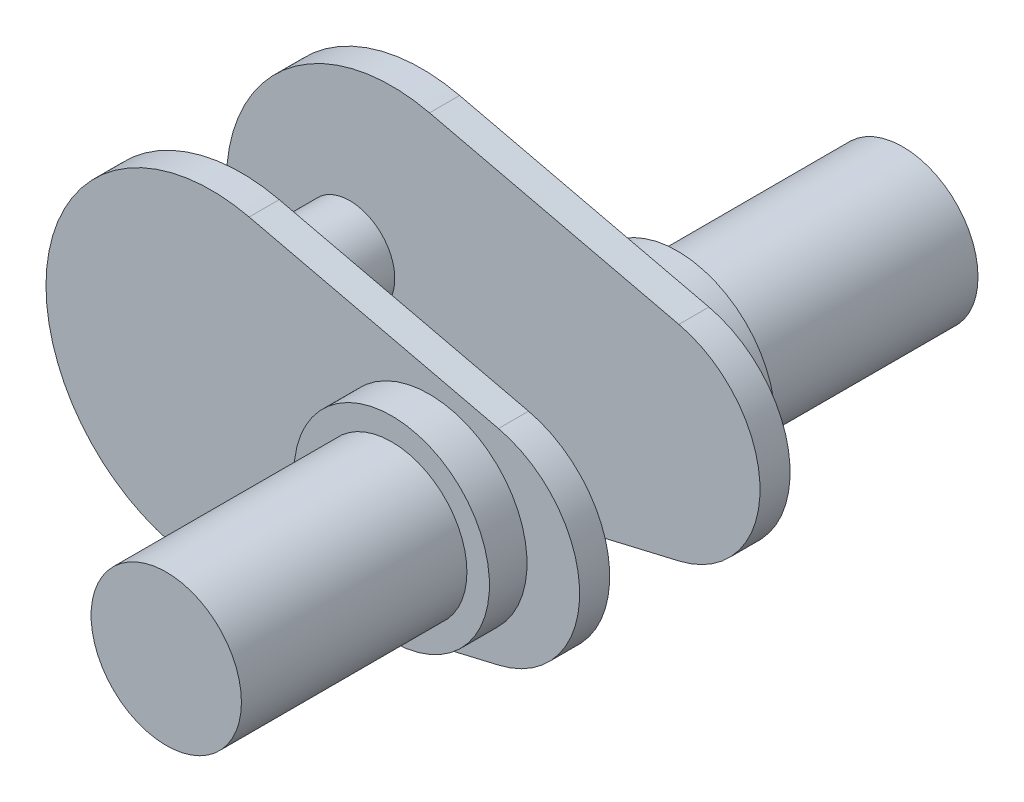
from build123d import *

# Parameters (mm, degrees)
SKETCH_1_R      = 10
EXTRUDE_1_DEPTH = 30
SKETCH_2_R      = 13
EXTRUDE_2_DEPTH = 5
EXTRUDE_3_DEPTH = 4
SKETCH_5_R      = 6
EXTRUDE_4_DEPTH = 10


with BuildPart() as part:
    # 草图1 → 拉伸1 (new body)
    with BuildSketch(Plane.XY):
        Circle(SKETCH_1_R)
    extrude_1 = extrude(amount=-EXTRUDE_1_DEPTH)

    # 草图2 → 拉伸2 (add)
    with BuildSketch(Plane(origin=(0, 0, -30), x_dir=(-1, 0, 0), z_dir=(0, 0, -1))):
        Circle(SKETCH_2_R)
    extrude_2 = extrude(amount=EXTRUDE_2_DEPTH)

    # 草图3 → 拉伸3 (add)
    with BuildSketch(Plane(origin=(0, 0, -35), x_dir=(-1, 0, 0), z_dir=(0, 0, -1))):
        with BuildLine():
            Line((-9.2, 13.62938003), (23.971428571, 21.41759719))
            ThreePointArc((23.971428571, 21.41759719), (51, 0), (23.971428571, -21.41759719))
            Line((23.971428571, -21.41759719), (-9.2, -13.62938003))
            ThreePointArc((-9.2, -13.62938003), (-20, 0), (-9.2, 13.62938003))
        make_face()
    extrude_3 = extrude(amount=EXTRUDE_3_DEPTH)

    # 草图5 → 拉伸4 (add)
    with BuildSketch(Plane(origin=(0, 0, -39), x_dir=(-1, 0, 0), z_dir=(0, 0, -1))):
        with Locations((34.589570742, 0)):
            Circle(SKETCH_5_R)
    extrude_4 = extrude(amount=EXTRUDE_4_DEPTH)

    # 镜向2: 拉伸1, 拉伸2, 拉伸3, 拉伸4 across plane
    add(extrude_1.mirror(Plane(origin=(-34.589570742, 0, -49), x_dir=(1, 0, 0), z_dir=(0, 0, -1))))
    add(extrude_2.mirror(Plane(origin=(-34.589570742, 0, -49), x_dir=(1, 0, 0), z_dir=(0, 0, -1))))
    add(extrude_3.mirror(Plane(origin=(-34.589570742, 0, -49), x_dir=(1, 0, 0), z_dir=(0, 0, -1))))
    add(extrude_4.mirror(Plane(origin=(-34.589570742, 0, -49), x_dir=(1, 0, 0), z_dir=(0, 0, -1))))


solid = part.part
